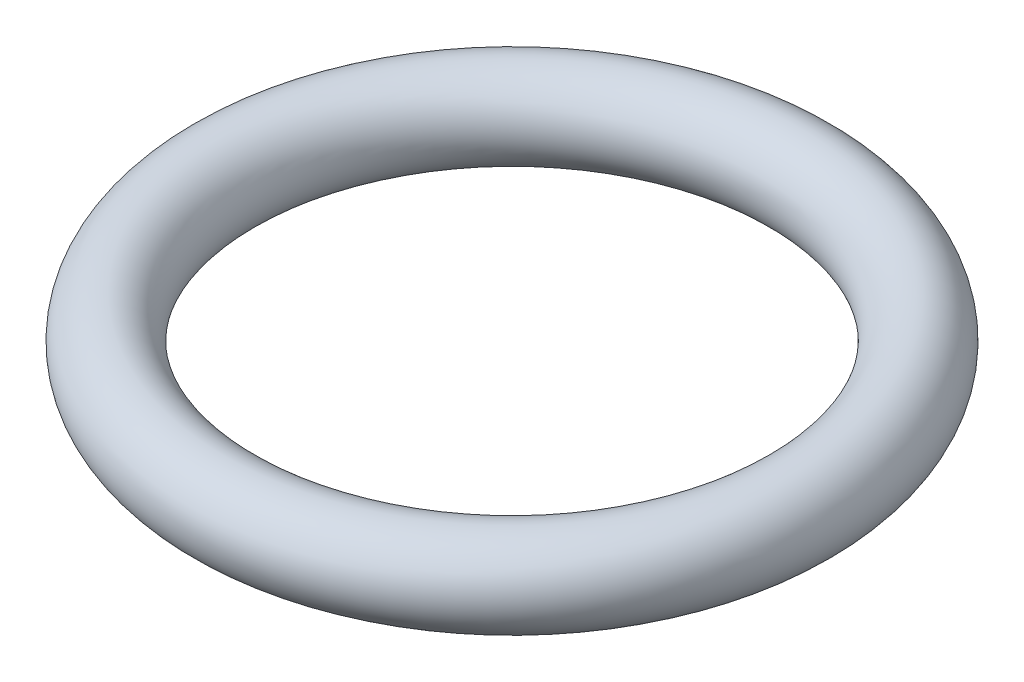
from build123d import *

# Parameters (mm, degrees)
SKETCH1_R = 0.79375


with BuildPart() as part:
    # Sketch1 → Revolve1 (revolve)
    with BuildSketch(Plane.XY):
        with Locations((5.3848, 0)):
            Circle(SKETCH1_R)
    revolve(axis=Axis((0, -68.34036257, 0), (0, 1, 0)))


solid = part.part
